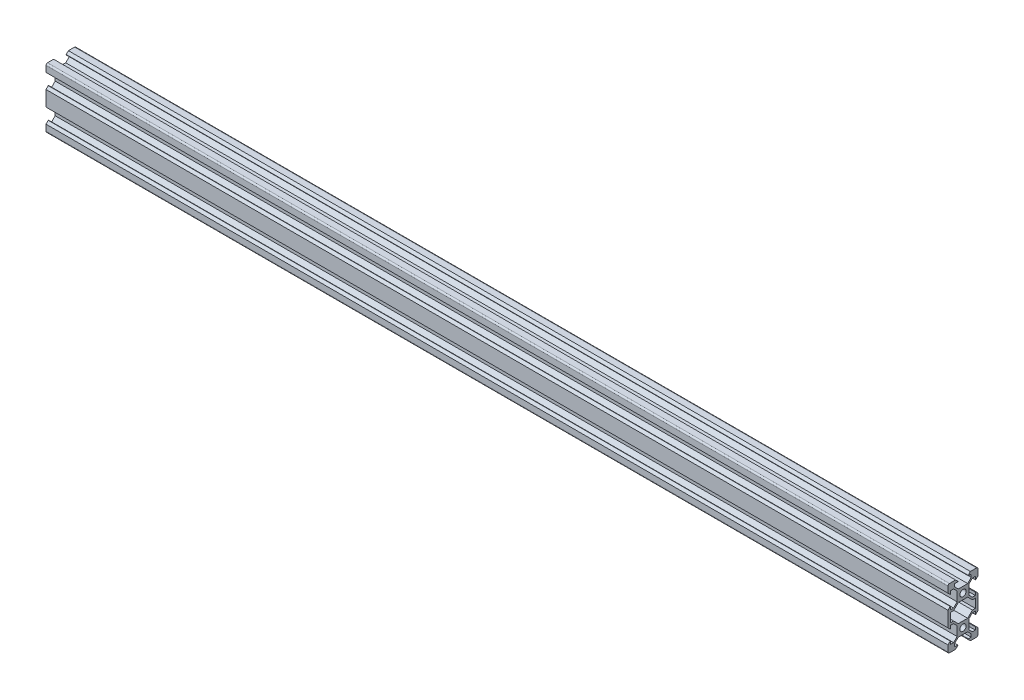
from build123d import *

# Parameters (mm, degrees)
SKETCH11_R             = 2.1
VSLOT2040_2040_1_DEPTH = 600.67800108


with BuildPart() as part:
    # Sketch11 → Vslot2040 2040(1) (new body)
    with BuildSketch(Plane(origin=(-300.33900054, 0, 0), x_dir=(0, 0, -1), z_dir=(1, 0, 0))):
        with BuildLine():
            Line((5.5, -18.2), (3.607842712, -18.2))
            ThreePointArc((3.607842712, -18.2), (3.423066806, -18.323463314), (3.466421356, -18.541421356))
            Line((3.466421356, -18.541421356), (4.925, -20))
            Line((4.925, -20), (9, -20))
            ThreePointArc((9, -20), (9.707106781, -19.707106781), (10, -19))
            Line((10, -19), (10, -14.925))
            Line((10, -14.925), (8.541421356, -13.466421356))
            ThreePointArc((8.541421356, -13.466421356), (8.323463314, -13.423066806), (8.2, -13.607842712))
            Line((8.2, -13.607842712), (8.2, -15.5))
            Line((8.2, -15.5), (6.275, -15.5))
            Line((6.275, -15.5), (3.9, -13.125))
            Line((3.9, -13.125), (3.9, -6.875))
            Line((3.9, -6.875), (6.275, -4.5))
            Line((6.275, -4.5), (8.2, -4.5))
            Line((8.2, -4.5), (8.2, -6.392157288))
            ThreePointArc((8.2, -6.392157288), (8.323463314, -6.576933194), (8.541421356, -6.533578644))
            Line((8.541421356, -6.533578644), (10, -5.075))
            Line((10, -5.075), (10, 5.075))
            Line((10, 5.075), (8.541421356, 6.533578644))
            ThreePointArc((8.541421356, 6.533578644), (8.323463314, 6.576933194), (8.2, 6.392157288))
            Line((8.2, 6.392157288), (8.2, 4.5))
            Line((8.2, 4.5), (6.275, 4.5))
            Line((6.275, 4.5), (3.9, 6.875))
            Line((3.9, 6.875), (3.9, 13.125))
            Line((3.9, 13.125), (6.275, 15.5))
            Line((6.275, 15.5), (8.2, 15.5))
            Line((8.2, 15.5), (8.2, 13.607842712))
            ThreePointArc((8.2, 13.607842712), (8.323463314, 13.423066806), (8.541421356, 13.466421356))
            Line((8.541421356, 13.466421356), (10, 14.925))
            Line((10, 14.925), (10, 19))
            ThreePointArc((10, 19), (9.707106781, 19.707106781), (9, 20))
            Line((9, 20), (4.925, 20))
            Line((4.925, 20), (3.466421356, 18.541421356))
            ThreePointArc((3.466421356, 18.541421356), (3.423066806, 18.323463314), (3.607842712, 18.2))
            Line((3.607842712, 18.2), (5.5, 18.2))
            Line((5.5, 18.2), (5.5, 16.275))
            Line((5.5, 16.275), (3.125, 13.9))
            Line((3.125, 13.9), (-3.125, 13.9))
            Line((-3.125, 13.9), (-5.5, 16.275))
            Line((-5.5, 16.275), (-5.5, 18.2))
            Line((-5.5, 18.2), (-3.607842712, 18.2))
            ThreePointArc((-3.607842712, 18.2), (-3.423066806, 18.323463314), (-3.466421356, 18.541421356))
            Line((-3.466421356, 18.541421356), (-4.925, 20))
            Line((-4.925, 20), (-9, 20))
            ThreePointArc((-9, 20), (-9.707106781, 19.707106781), (-10, 19))
            Line((-10, 19), (-10, 14.925))
            Line((-10, 14.925), (-8.541421356, 13.466421356))
            ThreePointArc((-8.541421356, 13.466421356), (-8.323463314, 13.423066806), (-8.2, 13.607842712))
            Line((-8.2, 13.607842712), (-8.2, 15.5))
            Line((-8.2, 15.5), (-6.275, 15.5))
            Line((-6.275, 15.5), (-3.9, 13.125))
            Line((-3.9, 13.125), (-3.9, 6.875))
            Line((-3.9, 6.875), (-6.275, 4.5))
            Line((-6.275, 4.5), (-8.2, 4.5))
            Line((-8.2, 4.5), (-8.2, 6.392157288))
            ThreePointArc((-8.2, 6.392157288), (-8.323463314, 6.576933194), (-8.541421356, 6.533578644))
            Line((-8.541421356, 6.533578644), (-10, 5.075))
            Line((-10, 5.075), (-10, -5.075))
            Line((-10, -5.075), (-8.541421356, -6.533578644))
            ThreePointArc((-8.541421356, -6.533578644), (-8.323463314, -6.576933194), (-8.2, -6.392157288))
            Line((-8.2, -6.392157288), (-8.2, -4.5))
            Line((-8.2, -4.5), (-6.275, -4.5))
            Line((-6.275, -4.5), (-3.9, -6.875))
            Line((-3.9, -6.875), (-3.9, -13.125))
            Line((-3.9, -13.125), (-6.275, -15.5))
            Line((-6.275, -15.5), (-8.2, -15.5))
            Line((-8.2, -15.5), (-8.2, -13.607842712))
            ThreePointArc((-8.2, -13.607842712), (-8.323463314, -13.423066806), (-8.541421356, -13.466421356))
            Line((-8.541421356, -13.466421356), (-10, -14.925))
            Line((-10, -14.925), (-10, -19))
            ThreePointArc((-10, -19), (-9.707106781, -19.707106781), (-9, -20))
            Line((-9, -20), (-4.925, -20))
            Line((-4.925, -20), (-3.466421356, -18.541421356))
            ThreePointArc((-3.466421356, -18.541421356), (-3.423066806, -18.323463314), (-3.607842712, -18.2))
            Line((-3.607842712, -18.2), (-5.5, -18.2))
            Line((-5.5, -18.2), (-5.5, -16.275))
            Line((-5.5, -16.275), (-3.125, -13.9))
            Line((-3.125, -13.9), (3.125, -13.9))
            Line((3.125, -13.9), (5.5, -16.275))
            Line((5.5, -16.275), (5.5, -18.2))
        make_face()
        with Locations((0, -10)):
            Circle(SKETCH11_R, mode=Mode.SUBTRACT)
        with Locations((0, 10)):
            Circle(SKETCH11_R, mode=Mode.SUBTRACT)
        Polygon((3.125, 6.1), (6.275, 2.95), (8.2, 2.95), (8.2, -2.95), (6.275, -2.95), (3.125, -6.1), (-3.125, -6.1), (-6.275, -2.95), (-8.2, -2.95), (-8.2, 2.95), (-6.275, 2.95), (-3.125, 6.1), align=None, mode=Mode.SUBTRACT)
    extrude(amount=VSLOT2040_2040_1_DEPTH)


solid = part.part
